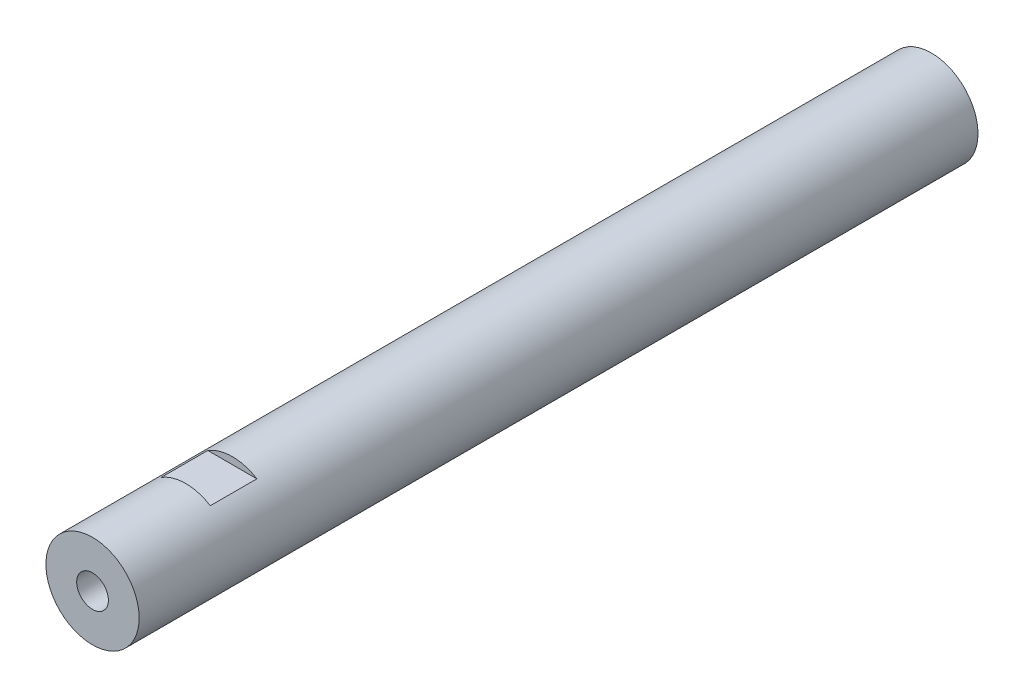
from build123d import *

# Parameters (mm, degrees)
SKIZZE1_R                       = 10
BASIS_LINEAR_AUSTRAGEN_DEPTH    = 90
SKIZZE5_W                       = 10.535653752
SKIZZE5_H                       = 1.5
SCHNITT_LINEAR_AUSTRAGEN1_DEPTH = 10


with BuildPart() as part:
    # Skizze1 → Basis-Linear austragen (new, symmetric)
    with BuildSketch(Plane.XY):
        with Locations(Location((0, 0, 0), (0, 0, 180))):
            Circle(SKIZZE1_R)
    extrude(amount=BASIS_LINEAR_AUSTRAGEN_DEPTH, both=True)

    # Skizze2 → M8 Gewindebohrung1 (revolve, cut)
    with BuildSketch(Plane(origin=(0, 0, 90), x_dir=(0, -1, 0), z_dir=(1, 0, 0))):
        Polygon((0, 0), (0, 24.292926105), (3.4, 22.25), (3.4, 0), align=None)
    m8_gewindebohrung1 = revolve(axis=Axis((0, 0, 96.35), (0, 0, -1)), mode=Mode.SUBTRACT)

    # Skizze5 → Schnitt-Linear austragen1 (cut)
    with BuildSketch(Plane.XY.offset(70)):
        with Locations((0, 9.25)):
            Rectangle(SKIZZE5_W, SKIZZE5_H)
        with Locations((0, -9.25)):
            Rectangle(SKIZZE5_W, SKIZZE5_H)
    extrude(amount=-SCHNITT_LINEAR_AUSTRAGEN1_DEPTH, mode=Mode.SUBTRACT)

    # Spiegeln1: M8 Gewindebohrung1 across plane
    add(m8_gewindebohrung1.mirror(Plane.XY), mode=Mode.SUBTRACT)


solid = part.part
